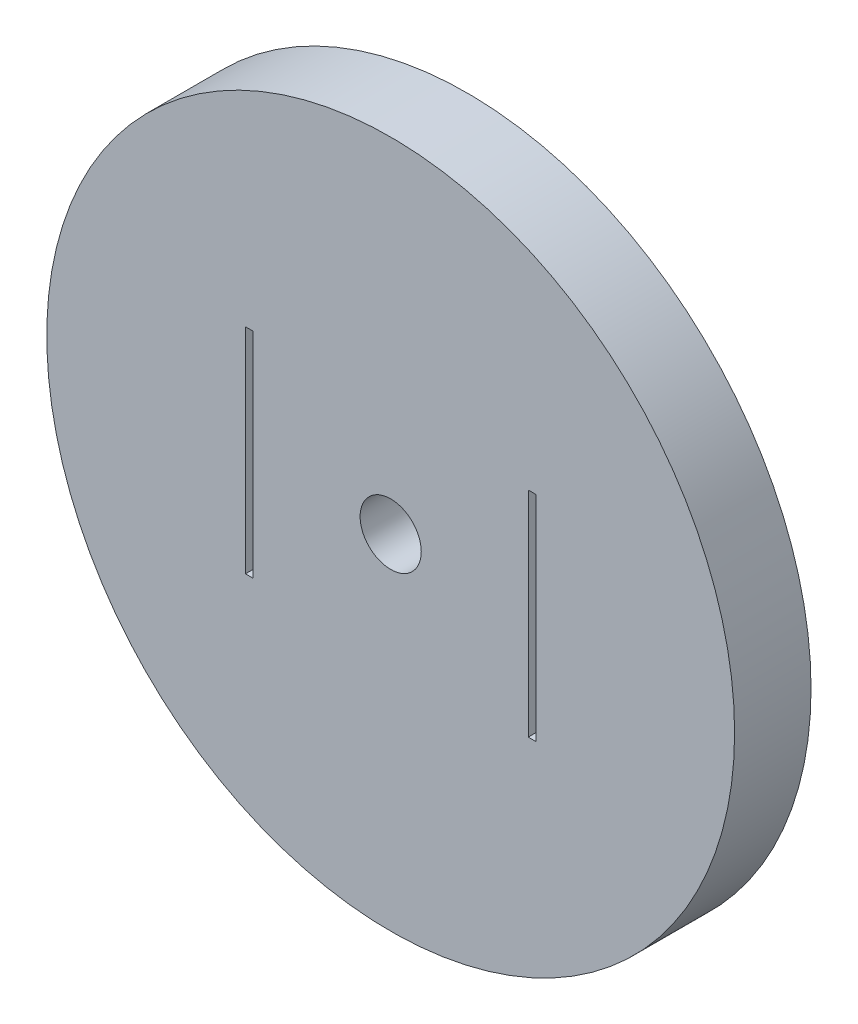
from build123d import *

# Parameters (mm, degrees)
SKETCH1_R           = 22.5
SKETCH1_R_2         = 2
SKETCH1_W           = 0.5
SKETCH1_H           = 14
BOSS_EXTRUDE1_DEPTH = 5


with BuildPart() as part:
    # Sketch1 → Boss-Extrude1 (new body)
    with BuildSketch(Plane.XY):
        Circle(SKETCH1_R)
        Circle(SKETCH1_R_2, mode=Mode.SUBTRACT)
        with Locations((-9.25, 0)):
            Rectangle(SKETCH1_W, SKETCH1_H, mode=Mode.SUBTRACT)
        with Locations((9.25, 0)):
            Rectangle(SKETCH1_W, SKETCH1_H, mode=Mode.SUBTRACT)
    extrude(amount=BOSS_EXTRUDE1_DEPTH)

    # Sketch3 → Revolve1 (revolve)
    with BuildSketch(Plane(origin=(0, 0, 0), x_dir=(1, 0, 0), z_dir=(0, 1, 0))):
        with BuildLine():
            Line((-17, 6), (-17, 0))
            Line((-17, 0), (-14.5, 0))
            Line((-14.5, 0), (-14.5, 8.5))
            ThreePointArc((-14.5, 8.5), (-16.267766953, 7.767766953), (-17, 6))
        make_face()
    revolve(axis=Axis((-14.5, 0, -6), (0, 0, 1)))


solid = part.part
